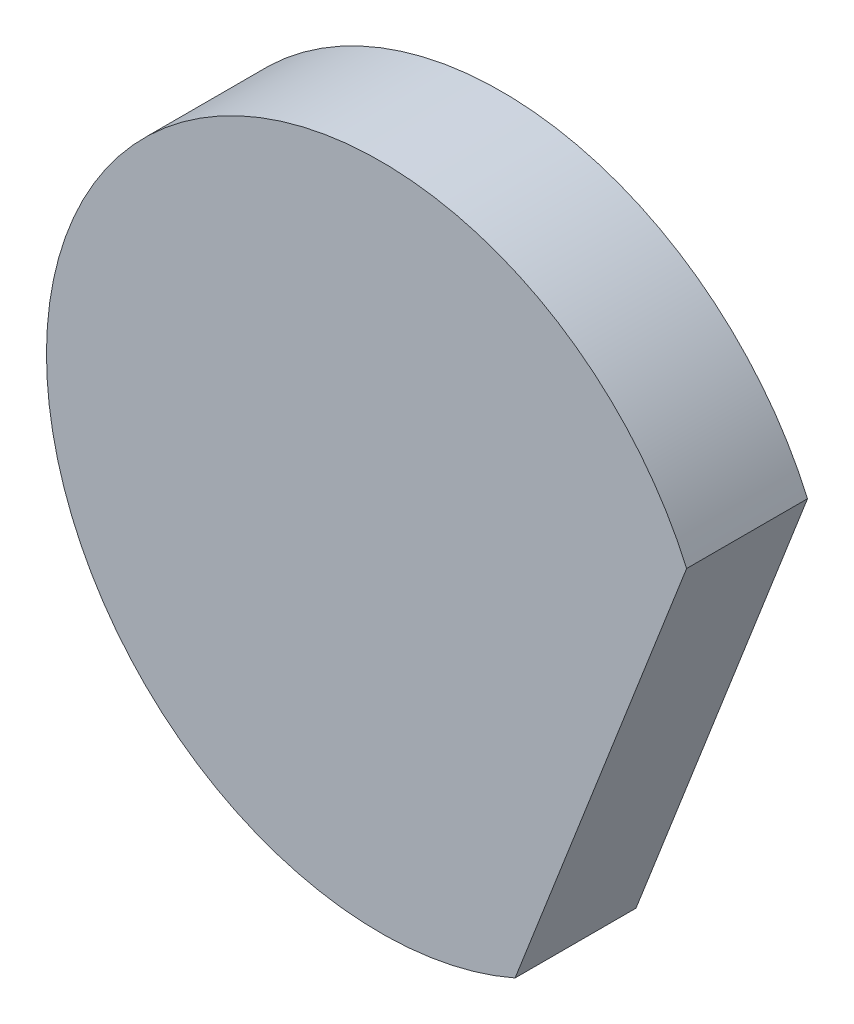
from build123d import *

# Parameters (mm, degrees)
CURVEBOSS_DEPTH = 7.139


with BuildPart() as part:
    # CurveSketch → CurveBoss (new body)
    with BuildSketch(Plane.XY):
        with BuildLine():
            Line((2.799822369, -4.345307673), (12.927307673, 21.655822369))
            ThreePointArc((12.927307673, 21.655822369), (-23.522575371, 20.880213535), (2.799822369, -4.345307673))
        make_face()
    extrude(amount=CURVEBOSS_DEPTH)


solid = part.part
